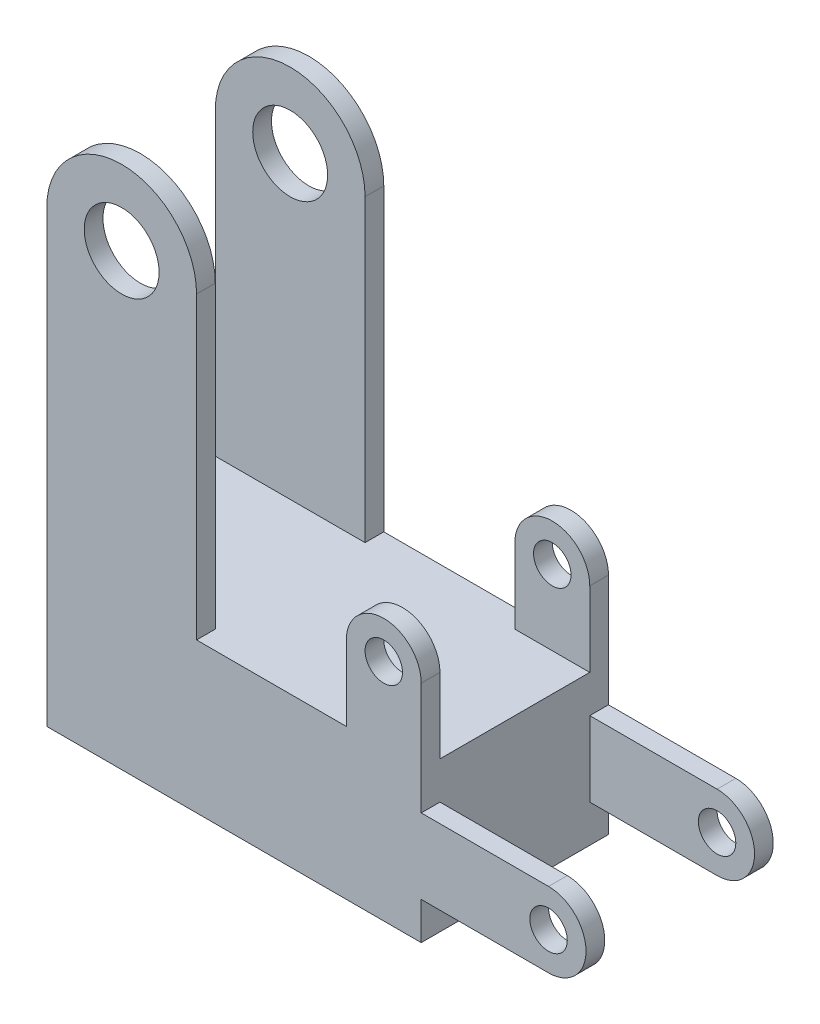
from build123d import *

# Parameters (mm, degrees)
BOSS_EXTRUDE1_DEPTH     = 25
CUT_EXTRUDE2_DEPTH      = 77.188110548
CUT_EXTRUDE2_DEPTH_BACK = 77.188110548
SKETCH3_W               = 20
SKETCH3_H               = 56.795841011
SKETCH4_R               = 5
CUT_EXTRUDE3_DEPTH      = 75.213706527
SKETCH5_R               = 2.5
CUT_EXTRUDE4_DEPTH      = 75.213706527
CUT_EXTRUDE5_REACH      = 79.827
SKETCH7_W               = 25.650683803
SKETCH7_H               = 20
SKETCH8_R               = 2.5
CUT_EXTRUDE6_DEPTH      = 75.213706527


with BuildPart() as part:
    # Sketch1 → Boss-Extrude1 (new body)
    with BuildSketch(Plane.XY):
        with BuildLine():
            Line((-49.061655574, -20.24431501), (-49.061655574, 39.75568499))
            ThreePointArc((-49.061655574, 39.75568499), (-39.061655574, 49.75568499), (-29.061655574, 39.75568499))
            Line((-29.061655574, 39.75568499), (-29.061655574, -0.24431501))
            Line((-29.061655574, -0.24431501), (-9.061655574, -0.24431501))
            Line((-9.061655574, -0.24431501), (-9.061655574, 9.75568499))
            ThreePointArc((-9.061655574, 9.75568499), (-4.061655574, 14.75568499), (0.938344426, 9.75568499))
            Line((0.938344426, 9.75568499), (0.938344426, -5.24431501))
            Line((0.938344426, -5.24431501), (17.938344426, -5.24431501))
            ThreePointArc((17.938344426, -5.24431501), (22.938344426, -10.24431501), (17.938344426, -15.24431501))
            Line((17.938344426, -15.24431501), (0.938344426, -15.24431501))
            Line((0.938344426, -15.24431501), (0.938344426, -20.24431501))
            Line((0.938344426, -20.24431501), (-49.061655574, -20.24431501))
        make_face()
    extrude(amount=BOSS_EXTRUDE1_DEPTH)

    # Sketch3 → Cut-Extrude2 (cut, two sides: drawn at the far end of the back side and taken through both)
    with BuildSketch(Plane(origin=(-29.061655574, 0, 0), x_dir=(0, 0, -1), z_dir=(1, 0, 0)).offset(-CUT_EXTRUDE2_DEPTH_BACK)):
        with Locations((-12.5, 28.153605496)):
            Rectangle(SKETCH3_W, SKETCH3_H)
    extrude(amount=CUT_EXTRUDE2_DEPTH + CUT_EXTRUDE2_DEPTH_BACK, mode=Mode.SUBTRACT)

    # Sketch4 → Cut-Extrude3 (cut, through all)
    with BuildSketch(Plane.XY.offset(25)):
        with Locations((-39.061655574, 39.75568499)):
            Circle(SKETCH4_R)
    extrude(amount=-CUT_EXTRUDE3_DEPTH, mode=Mode.SUBTRACT)

    # Sketch5 → Cut-Extrude4 (cut, through all)
    with BuildSketch(Plane.XY.offset(25)):
        with Locations((-4.061655574, 9.75568499)):
            Circle(SKETCH5_R)
    extrude(amount=-CUT_EXTRUDE4_DEPTH, mode=Mode.SUBTRACT)

    # Sketch7 → Cut-Extrude5 (cut, up to next)
    with BuildSketch(Plane(origin=(0, -5.24431501, 0), x_dir=(1, 0, 0), z_dir=(0, 1, 0)), mode=Mode.PRIVATE) as cut_extrude5_sk1:
        with Locations((13.763686328, -12.5)):
            Rectangle(SKETCH7_W, SKETCH7_H)
    cut_extrude5_tool1 = extrude(cut_extrude5_sk1.sketch, amount=-CUT_EXTRUDE5_REACH, mode=Mode.PRIVATE) & part.part
    add(cut_extrude5_tool1.solids().sort_by_distance((13.763686, -5.244315, 12.5))[0], mode=Mode.SUBTRACT)

    # Sketch8 → Cut-Extrude6 (cut, through all)
    with BuildSketch(Plane.XY.offset(25)):
        with Locations((17.938344426, -10.24431501)):
            Circle(SKETCH8_R)
    extrude(amount=-CUT_EXTRUDE6_DEPTH, mode=Mode.SUBTRACT)


solid = part.part
